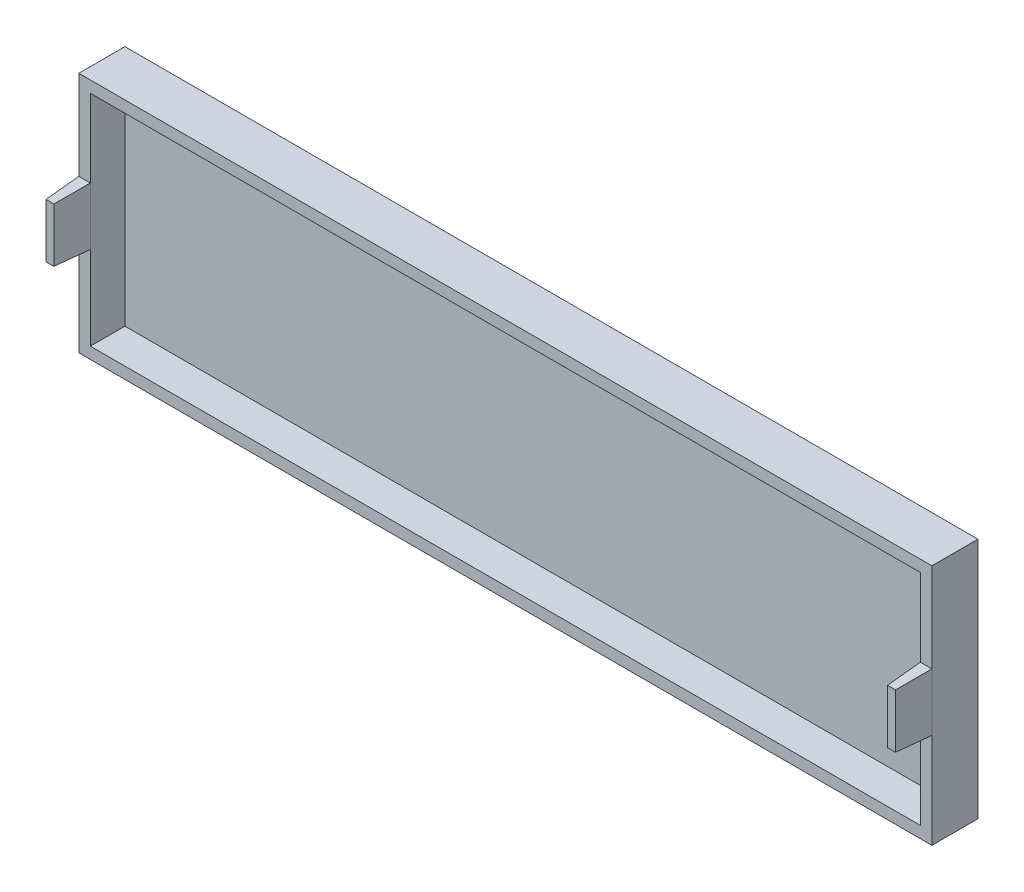
from build123d import *

# Parameters (mm, degrees)
SCHIZZO1_W                   = 148
SCHIZZO1_H                   = 42
ESTRUSIONE_ESTRUSIONE1_DEPTH = 2
SCHIZZO2_W                   = 148
SCHIZZO2_H                   = 42
SCHIZZO2_W_2                 = 144
SCHIZZO2_H_2                 = 38
ESTRUSIONE_ESTRUSIONE2_DEPTH = 6
SCHIZZO3_W                   = 2
SCHIZZO3_H                   = 10
ESTRUSIONE_ESTRUSIONE3_DEPTH = 6
ESTRUSIONE_ESTRUSIONE3_TAPER = 3


with BuildPart() as part:
    # Schizzo1 → Estrusione-Estrusione1 (new body)
    with BuildSketch(Plane.XY):
        Rectangle(SCHIZZO1_W, SCHIZZO1_H)
    extrude(amount=ESTRUSIONE_ESTRUSIONE1_DEPTH)

    # Schizzo2 → Estrusione-Estrusione2 (add)
    with BuildSketch(Plane.XY.offset(2)):
        Rectangle(SCHIZZO2_W, SCHIZZO2_H)
        Rectangle(SCHIZZO2_W_2, SCHIZZO2_H_2, mode=Mode.SUBTRACT)
    extrude(amount=ESTRUSIONE_ESTRUSIONE2_DEPTH)

    # Schizzo3 → Estrusione-Estrusione3 (add)
    with BuildSketch(Plane.XY.offset(8)):
        with Locations((-73, 0.515392861)):
            Rectangle(SCHIZZO3_W, SCHIZZO3_H)
    estrusione_estrusione3 = extrude(amount=ESTRUSIONE_ESTRUSIONE3_DEPTH, taper=ESTRUSIONE_ESTRUSIONE3_TAPER)

    # Specchia1: Estrusione-Estrusione3 across plane
    add(estrusione_estrusione3.mirror(Plane(origin=(0, 0, 0), x_dir=(0, 0, 1), z_dir=(1, 0, 0))))


solid = part.part
